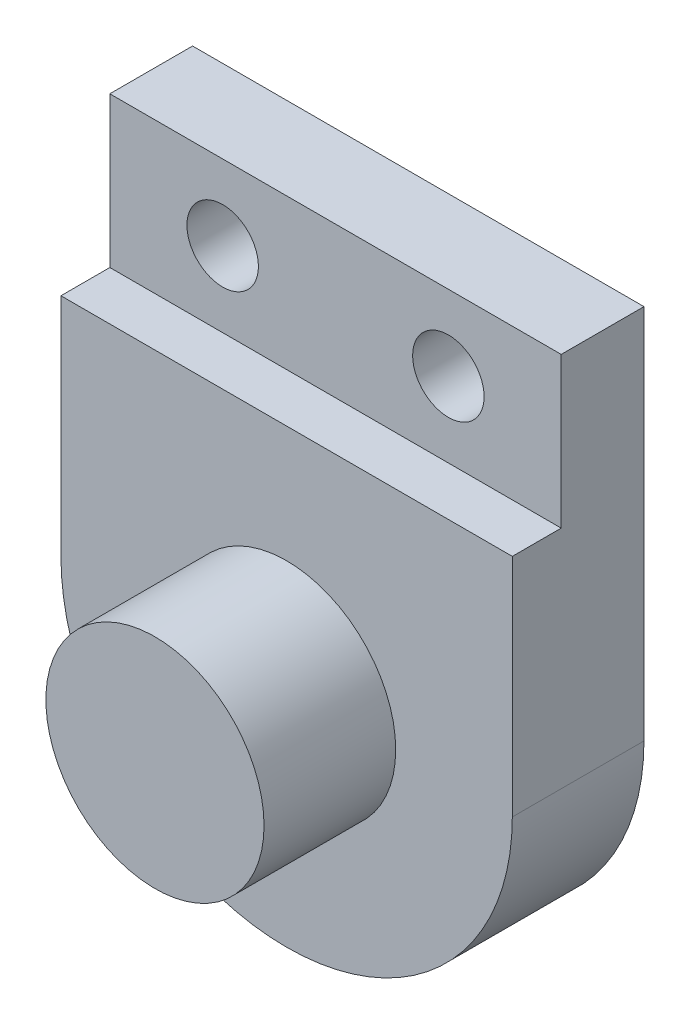
from build123d import *

# Parameters (mm, degrees)
SKETCH_1_R          = 2.9
EXTRUDE_1_DEPTH     = 3
SKETCH_1_4_W        = 12
SKETCH_1_4_H        = 4
SKETCH_1_4_R        = 0.95
EXTRUDE_2_DEPTH     = 2.2
SKETCH_1_5_R        = 2.9
EXTRUDE_3_DEPTH     = 6
SKETCH_2_R          = 1.85
CUT_EXTRUDE_1_DEPTH = 0.3
EXTRUDE_4_DEPTH     = 0.5
SKETCH_1_7_R        = 2.9
EXTRUDE_6_DEPTH     = 7


with BuildPart() as part:
    # 草图1 → 凸台-拉伸1 (new body)
    with BuildSketch(Plane.XY):
        with BuildLine():
            Line((0, 0), (12, 0))
            Line((12, 0), (12, -6))
            ThreePointArc((12, -6), (6, -12), (0, -6))
            Line((0, -6), (0, 0))
        make_face()
        with Locations((6, -6)):
            Circle(SKETCH_1_R, mode=Mode.SUBTRACT)
    extrude(amount=EXTRUDE_1_DEPTH)

    # 草图1<4> → 凸台-拉伸2 (add)
    with BuildSketch(Plane.XY):
        with Locations((6, 2)):
            Rectangle(SKETCH_1_4_W, SKETCH_1_4_H)
        with Locations((9, 2)):
            Circle(SKETCH_1_4_R, mode=Mode.SUBTRACT)
        with Locations((3, 2)):
            Circle(SKETCH_1_4_R, mode=Mode.SUBTRACT)
    extrude(amount=EXTRUDE_2_DEPTH)

    # 草图1<5> → 凸台-拉伸3 (add)
    with BuildSketch(Plane.XY):
        with Locations((6, -6)):
            Circle(SKETCH_1_5_R)
    extrude(amount=EXTRUDE_3_DEPTH)

    # 草图2 → 切除-拉伸1 (cut)
    with BuildSketch(Plane(origin=(0, 0, 0), x_dir=(-1, 0, 0), z_dir=(0, 0, -1))):
        with Locations((-9, 2)):
            Circle(SKETCH_2_R)
        with Locations((-3, 2)):
            Circle(SKETCH_2_R)
    extrude(amount=-CUT_EXTRUDE_1_DEPTH, mode=Mode.SUBTRACT)

    # 草图4 → 凸台-拉伸4 (add)
    with BuildSketch(Plane.XY.offset(3)):
        with BuildLine():
            Line((0, 0), (12, 0))
            Line((12, 0), (12.000004167, -6))
            ThreePointArc((12.000004167, -6), (6, -12), (0, -6))
            Line((0, -6), (0, 0))
        make_face()
    extrude(amount=EXTRUDE_4_DEPTH)

    # 草图1<7> → 凸台-拉伸6 (add)
    with BuildSketch(Plane.XY):
        with Locations((6, -6)):
            Circle(SKETCH_1_7_R)
    extrude(amount=EXTRUDE_6_DEPTH)


solid = part.part
